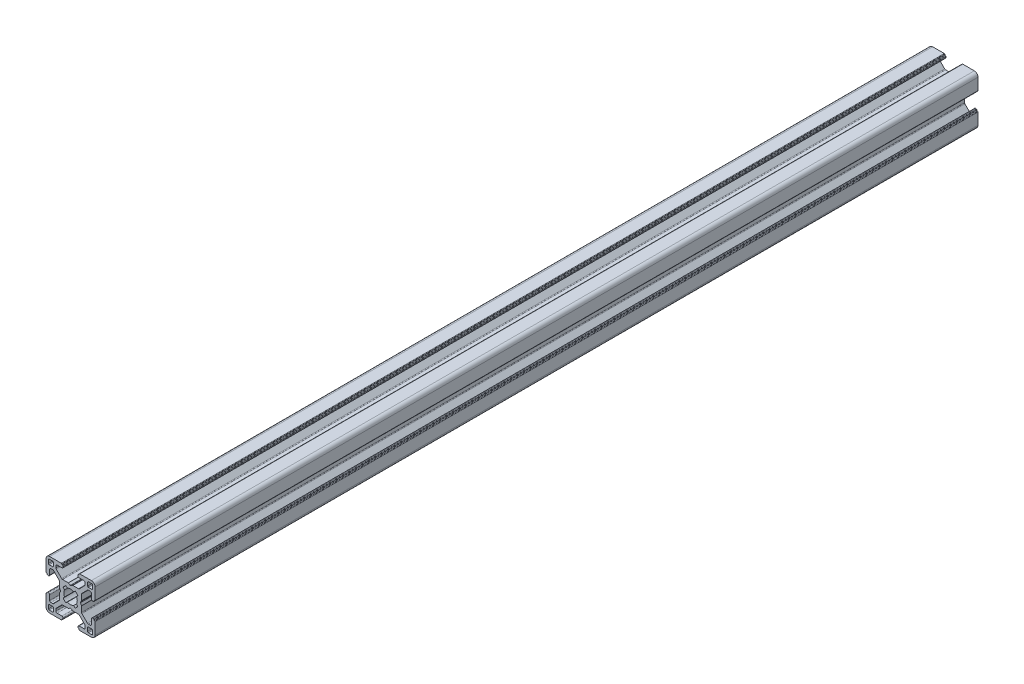
from build123d import *

# Parameters (mm, degrees)
ESTRUSIONE_ESTRUSIONE1_DEPTH = 360


with BuildPart() as part:
    # Schizzo1 → Estrusione-Estrusione1 (new body)
    with BuildSketch(Plane.XY.offset(100)):
        with BuildLine():
            Line((-9.299999732, 3), (-8.999999732, 3))
            ThreePointArc((-8.999999732, 3), (-8.646446341, 3.146446609), (-8.499999732, 3.5))
            Line((-8.499999732, 3.5), (-8.499999732, 5.499999605))
            ThreePointArc((-8.499999732, 5.499999605), (-8.353553123, 5.853552995), (-7.999999732, 5.999999605))
            Line((-7.999999732, 5.999999605), (-7.267766685, 5.999999605))
            ThreePointArc((-7.267766685, 5.999999605), (-7.076424969, 5.961939371), (-6.914213294, 5.853552995))
            Line((-6.914213294, 5.853552995), (-4.646446398, 3.585786099))
            ThreePointArc((-4.646446398, 3.585786099), (-4.538060023, 3.423574425), (-4.499999789, 3.232232708))
            Line((-4.499999789, 3.232232708), (-4.499999789, 0.953589302))
            ThreePointArc((-4.499999789, 0.953589302), (-4.493184953, 0.90182549), (-4.473204867, 0.853589297))
            Line((-4.473204867, 0.853589297), (-4.038119841, 0.099999969))
            ThreePointArc((-4.038119841, 0.099999969), (-4.011324929, 0), (-4.038119841, -0.099999969))
            Line((-4.038119841, -0.099999969), (-4.473204867, -0.853589297))
            ThreePointArc((-4.473204867, -0.853589297), (-4.493184953, -0.90182549), (-4.499999789, -0.953589302))
            Line((-4.499999789, -0.953589302), (-4.499999789, -3.232232708))
            ThreePointArc((-4.499999789, -3.232232708), (-4.538060023, -3.423574425), (-4.646446398, -3.585786099))
            Line((-4.646446398, -3.585786099), (-6.914213294, -5.853552995))
            ThreePointArc((-6.914213294, -5.853552995), (-7.076424969, -5.961939371), (-7.267766685, -5.999999605))
            Line((-7.267766685, -5.999999605), (-7.999999732, -5.999999605))
            ThreePointArc((-7.999999732, -5.999999605), (-8.353553123, -5.853552995), (-8.499999732, -5.499999605))
            Line((-8.499999732, -5.499999605), (-8.499999732, -3.5))
            ThreePointArc((-8.499999732, -3.5), (-8.646446341, -3.146446609), (-8.999999732, -3))
            Line((-8.999999732, -3), (-9.299999732, -3))
            ThreePointArc((-9.299999732, -3), (-9.441421088, -3.058578644), (-9.499999732, -3.2))
            Line((-9.499999732, -3.2), (-9.499999732, -3.349999605))
            ThreePointArc((-9.499999732, -3.349999605), (-9.558578376, -3.491420961), (-9.699999732, -3.549999605))
            Line((-9.699999732, -3.549999605), (-9.8, -3.549999605))
            ThreePointArc((-9.8, -3.549999605), (-9.941421356, -3.608578248), (-10, -3.749999605))
            Line((-10, -3.749999605), (-10, -8.5))
            ThreePointArc((-10, -8.5), (-9.560660172, -9.560660172), (-8.5, -10))
            Line((-8.5, -10), (-3.750000228, -10))
            ThreePointArc((-3.750000228, -10), (-3.608578871, -9.941421356), (-3.550000228, -9.8))
            Line((-3.550000228, -9.8), (-3.550000228, -9.7))
            ThreePointArc((-3.550000228, -9.7), (-3.491421584, -9.558578644), (-3.350000228, -9.5))
            Line((-3.350000228, -9.5), (-3.2, -9.5))
            ThreePointArc((-3.2, -9.5), (-3.058578644, -9.441421356), (-3, -9.3))
            Line((-3, -9.3), (-3, -8.999999673))
            ThreePointArc((-3, -8.999999673), (-3.146446609, -8.646446283), (-3.5, -8.499999673))
            Line((-3.5, -8.499999673), (-5.500000686, -8.499999673))
            ThreePointArc((-5.500000686, -8.499999673), (-5.853554077, -8.353553064), (-6.000000686, -7.999999673))
            Line((-6.000000686, -7.999999673), (-6.000000686, -7.267766626))
            ThreePointArc((-6.000000686, -7.267766626), (-5.961940448, -7.076424899), (-5.853554059, -6.914213219))
            Line((-5.853554059, -6.914213219), (-3.585787212, -4.646446592))
            ThreePointArc((-3.585787212, -4.646446592), (-3.423575544, -4.538060229), (-3.232233839, -4.5))
            Line((-3.232233839, -4.5), (-0.953590312, -4.5))
            ThreePointArc((-0.953590312, -4.5), (-0.901826505, -4.493185166), (-0.853590316, -4.473205083))
            Line((-0.853590316, -4.473205083), (-0.100000045, -4.038119562))
            ThreePointArc((-0.100000045, -4.038119562), (0, -4.011324632), (0.100000045, -4.038119562))
            Line((0.100000045, -4.038119562), (0.853590316, -4.473205083))
            ThreePointArc((0.853590316, -4.473205083), (0.901826505, -4.493185166), (0.953590312, -4.5))
            Line((0.953590312, -4.5), (3.23223292, -4.5))
            ThreePointArc((3.23223292, -4.5), (3.423574636, -4.538060234), (3.58578631, -4.646446609))
            Line((3.58578631, -4.646446609), (5.853554077, -6.914214376))
            ThreePointArc((5.853554077, -6.914214376), (5.961940452, -7.07642605), (6.000000686, -7.267767766))
            Line((6.000000686, -7.267767766), (6.000000686, -7.999999673))
            ThreePointArc((6.000000686, -7.999999673), (5.853554077, -8.353553064), (5.500000686, -8.499999673))
            Line((5.500000686, -8.499999673), (3.5, -8.499999673))
            ThreePointArc((3.5, -8.499999673), (3.146446609, -8.646446283), (3, -8.999999673))
            Line((3, -8.999999673), (3, -9.3))
            ThreePointArc((3, -9.3), (3.058578644, -9.441421356), (3.2, -9.5))
            Line((3.2, -9.5), (3.350000228, -9.5))
            ThreePointArc((3.350000228, -9.5), (3.491421584, -9.558578644), (3.550000228, -9.7))
            Line((3.550000228, -9.7), (3.550000228, -9.8))
            ThreePointArc((3.550000228, -9.8), (3.608578871, -9.941421356), (3.750000228, -10))
            Line((3.750000228, -10), (8.5, -10))
            ThreePointArc((8.5, -10), (9.560660172, -9.560660172), (10, -8.5))
            Line((10, -8.5), (10, -3.749999605))
            ThreePointArc((10, -3.749999605), (9.941421356, -3.608578248), (9.8, -3.549999605))
            Line((9.8, -3.549999605), (9.699999732, -3.549999605))
            ThreePointArc((9.699999732, -3.549999605), (9.558578376, -3.491420961), (9.499999732, -3.349999605))
            Line((9.499999732, -3.349999605), (9.499999732, -3.2))
            ThreePointArc((9.499999732, -3.2), (9.441421088, -3.058578644), (9.299999732, -3))
            Line((9.299999732, -3), (8.999999732, -3))
            ThreePointArc((8.999999732, -3), (8.646446341, -3.146446609), (8.499999732, -3.5))
            Line((8.499999732, -3.5), (8.499999732, -5.499999605))
            ThreePointArc((8.499999732, -5.499999605), (8.353553123, -5.853552995), (7.999999732, -5.999999605))
            Line((7.999999732, -5.999999605), (7.267766789, -5.999999605))
            ThreePointArc((7.267766789, -5.999999605), (7.076425084, -5.961939376), (6.914213416, -5.853553012))
            Line((6.914213416, -5.853553012), (4.646446415, -3.585786233))
            ThreePointArc((4.646446415, -3.585786233), (4.538060027, -3.423574553), (4.499999789, -3.232232825))
            Line((4.499999789, -3.232232825), (4.499999789, -0.953589302))
            ThreePointArc((4.499999789, -0.953589302), (4.493184953, -0.90182549), (4.473204867, -0.853589297))
            Line((4.473204867, -0.853589297), (4.038119841, -0.099999969))
            ThreePointArc((4.038119841, -0.099999969), (4.011324929, 0), (4.038119841, 0.099999969))
            Line((4.038119841, 0.099999969), (4.473204867, 0.853589297))
            ThreePointArc((4.473204867, 0.853589297), (4.493184953, 0.90182549), (4.499999789, 0.953589302))
            Line((4.499999789, 0.953589302), (4.499999789, 3.232232825))
            ThreePointArc((4.499999789, 3.232232825), (4.538060027, 3.423574553), (4.646446415, 3.585786233))
            Line((4.646446415, 3.585786233), (6.914213416, 5.853553012))
            ThreePointArc((6.914213416, 5.853553012), (7.076425084, 5.961939376), (7.267766789, 5.999999605))
            Line((7.267766789, 5.999999605), (7.999999732, 5.999999605))
            ThreePointArc((7.999999732, 5.999999605), (8.353553123, 5.853552995), (8.499999732, 5.499999605))
            Line((8.499999732, 5.499999605), (8.499999732, 3.5))
            ThreePointArc((8.499999732, 3.5), (8.646446341, 3.146446609), (8.999999732, 3))
            Line((8.999999732, 3), (9.299999732, 3))
            ThreePointArc((9.299999732, 3), (9.441421088, 3.058578644), (9.499999732, 3.2))
            Line((9.499999732, 3.2), (9.499999732, 3.349999605))
            ThreePointArc((9.499999732, 3.349999605), (9.558578376, 3.491420961), (9.699999732, 3.549999605))
            Line((9.699999732, 3.549999605), (9.8, 3.549999605))
            ThreePointArc((9.8, 3.549999605), (9.941421356, 3.608578248), (10, 3.749999605))
            Line((10, 3.749999605), (10, 8.5))
            ThreePointArc((10, 8.5), (9.560660172, 9.560660172), (8.5, 10))
            Line((8.5, 10), (3.750000228, 10))
            ThreePointArc((3.750000228, 10), (3.608578871, 9.941421356), (3.550000228, 9.8))
            Line((3.550000228, 9.8), (3.550000228, 9.7))
            ThreePointArc((3.550000228, 9.7), (3.491421584, 9.558578644), (3.350000228, 9.5))
            Line((3.350000228, 9.5), (3.2, 9.5))
            ThreePointArc((3.2, 9.5), (3.058578644, 9.441421356), (3, 9.3))
            Line((3, 9.3), (3, 8.999999673))
            ThreePointArc((3, 8.999999673), (3.146446609, 8.646446283), (3.5, 8.499999673))
            Line((3.5, 8.499999673), (5.500000686, 8.499999673))
            ThreePointArc((5.500000686, 8.499999673), (5.853554077, 8.353553064), (6.000000686, 7.999999673))
            Line((6.000000686, 7.999999673), (6.000000686, 7.267767766))
            ThreePointArc((6.000000686, 7.267767766), (5.961940452, 7.07642605), (5.853554077, 6.914214376))
            Line((5.853554077, 6.914214376), (3.58578631, 4.646446609))
            ThreePointArc((3.58578631, 4.646446609), (3.423574636, 4.538060234), (3.23223292, 4.5))
            Line((3.23223292, 4.5), (0.953590312, 4.5))
            ThreePointArc((0.953590312, 4.5), (0.901826505, 4.493185166), (0.853590316, 4.473205083))
            Line((0.853590316, 4.473205083), (0.100000045, 4.038119562))
            ThreePointArc((0.100000045, 4.038119562), (0, 4.011324632), (-0.100000045, 4.038119562))
            Line((-0.100000045, 4.038119562), (-0.853590316, 4.473205083))
            ThreePointArc((-0.853590316, 4.473205083), (-0.901826505, 4.493185166), (-0.953590312, 4.5))
            Line((-0.953590312, 4.5), (-3.232233839, 4.5))
            ThreePointArc((-3.232233839, 4.5), (-3.423575544, 4.538060229), (-3.585787212, 4.646446592))
            Line((-3.585787212, 4.646446592), (-5.853554059, 6.914213219))
            ThreePointArc((-5.853554059, 6.914213219), (-5.961940448, 7.076424899), (-6.000000686, 7.267766626))
            Line((-6.000000686, 7.267766626), (-6.000000686, 7.999999673))
            ThreePointArc((-6.000000686, 7.999999673), (-5.853554077, 8.353553064), (-5.500000686, 8.499999673))
            Line((-5.500000686, 8.499999673), (-3.5, 8.499999673))
            ThreePointArc((-3.5, 8.499999673), (-3.146446609, 8.646446283), (-3, 8.999999673))
            Line((-3, 8.999999673), (-3, 9.3))
            ThreePointArc((-3, 9.3), (-3.058578644, 9.441421356), (-3.2, 9.5))
            Line((-3.2, 9.5), (-3.350000228, 9.5))
            ThreePointArc((-3.350000228, 9.5), (-3.491421584, 9.558578644), (-3.550000228, 9.7))
            Line((-3.550000228, 9.7), (-3.550000228, 9.8))
            ThreePointArc((-3.550000228, 9.8), (-3.608578871, 9.941421356), (-3.750000228, 10))
            Line((-3.750000228, 10), (-8.5, 10))
            ThreePointArc((-8.5, 10), (-9.560660172, 9.560660172), (-10, 8.5))
            Line((-10, 8.5), (-10, 3.749999605))
            ThreePointArc((-10, 3.749999605), (-9.941421356, 3.608578248), (-9.8, 3.549999605))
            Line((-9.8, 3.549999605), (-9.699999732, 3.549999605))
            ThreePointArc((-9.699999732, 3.549999605), (-9.558578376, 3.491420961), (-9.499999732, 3.349999605))
            Line((-9.499999732, 3.349999605), (-9.499999732, 3.2))
            ThreePointArc((-9.499999732, 3.2), (-9.441421088, 3.058578644), (-9.299999732, 3))
        make_face()
        with BuildLine():
            Line((-1.91389502, 2.989640962), (-1.258185436, 2.445295362))
            ThreePointArc((-1.258185436, 2.445295362), (0, 2.75), (1.258185436, 2.445295362))
            Line((1.258185436, 2.445295362), (1.91389502, 2.989640962))
            ThreePointArc((1.91389502, 2.989640962), (2.511737261, 2.508410485), (2.992174953, 1.909930962))
            Line((2.992174953, 1.909930962), (2.445295423, 1.258185317))
            ThreePointArc((2.445295423, 1.258185317), (2.75, 0), (2.445295423, -1.258185317))
            Line((2.445295423, -1.258185317), (2.992174953, -1.909930962))
            ThreePointArc((2.992174953, -1.909930962), (2.511737261, -2.508410485), (1.91389502, -2.989640962))
            Line((1.91389502, -2.989640962), (1.258185436, -2.445295362))
            ThreePointArc((1.258185436, -2.445295362), (0, -2.75), (-1.258185436, -2.445295362))
            Line((-1.258185436, -2.445295362), (-1.91389502, -2.989640962))
            ThreePointArc((-1.91389502, -2.989640962), (-2.511737261, -2.508410485), (-2.992174953, -1.909930962))
            Line((-2.992174953, -1.909930962), (-2.445295423, -1.258185317))
            ThreePointArc((-2.445295423, -1.258185317), (-2.75, 0), (-2.445295423, 1.258185317))
            Line((-2.445295423, 1.258185317), (-2.992174953, 1.909930962))
            ThreePointArc((-2.992174953, 1.909930962), (-2.511737261, 2.508410485), (-1.91389502, 2.989640962))
        make_face(mode=Mode.SUBTRACT)
        with BuildLine():
            Line((8.699999314, 7.000000686), (7.3, 7.000000686))
            ThreePointArc((7.3, 7.000000686), (7.087867966, 7.087868652), (7, 7.300000686))
            Line((7, 7.300000686), (7, 8.7))
            ThreePointArc((7, 8.7), (7.087867966, 8.912132034), (7.3, 9))
            Line((7.3, 9), (8.699999314, 9))
            ThreePointArc((8.699999314, 9), (8.912131348, 8.912132034), (8.999999314, 8.7))
            Line((8.999999314, 8.7), (8.999999314, 7.300000686))
            ThreePointArc((8.999999314, 7.300000686), (8.912131348, 7.087868652), (8.699999314, 7.000000686))
        make_face(mode=Mode.SUBTRACT)
        with BuildLine():
            Line((-7.300000686, 7.000000686), (-8.7, 7.000000686))
            ThreePointArc((-8.7, 7.000000686), (-8.912132034, 7.087868652), (-9, 7.300000686))
            Line((-9, 7.300000686), (-9, 8.7))
            ThreePointArc((-9, 8.7), (-8.912132034, 8.912132034), (-8.7, 9))
            Line((-8.7, 9), (-7.300000686, 9))
            ThreePointArc((-7.300000686, 9), (-7.087868652, 8.912132034), (-7.000000686, 8.7))
            Line((-7.000000686, 8.7), (-7.000000686, 7.300000686))
            ThreePointArc((-7.000000686, 7.300000686), (-7.087868652, 7.087868652), (-7.300000686, 7.000000686))
        make_face(mode=Mode.SUBTRACT)
        with BuildLine():
            Line((8.699999314, -8.999999314), (7.3, -8.999999314))
            ThreePointArc((7.3, -8.999999314), (7.087867966, -8.912131348), (7, -8.699999314))
            Line((7, -8.699999314), (7, -7.3))
            ThreePointArc((7, -7.3), (7.087867966, -7.087867966), (7.3, -7))
            Line((7.3, -7), (8.699999314, -7))
            ThreePointArc((8.699999314, -7), (8.912131348, -7.087867966), (8.999999314, -7.3))
            Line((8.999999314, -7.3), (8.999999314, -8.699999314))
            ThreePointArc((8.999999314, -8.699999314), (8.912131348, -8.912131348), (8.699999314, -8.999999314))
        make_face(mode=Mode.SUBTRACT)
        with BuildLine():
            Line((-7.300000686, -8.999999314), (-8.7, -8.999999314))
            ThreePointArc((-8.7, -8.999999314), (-8.912132034, -8.912131348), (-9, -8.699999314))
            Line((-9, -8.699999314), (-9, -7.3))
            ThreePointArc((-9, -7.3), (-8.912132034, -7.087867966), (-8.7, -7))
            Line((-8.7, -7), (-7.300000686, -7))
            ThreePointArc((-7.300000686, -7), (-7.087868652, -7.087867966), (-7.000000686, -7.3))
            Line((-7.000000686, -7.3), (-7.000000686, -8.699999314))
            ThreePointArc((-7.000000686, -8.699999314), (-7.087868652, -8.912131348), (-7.300000686, -8.999999314))
        make_face(mode=Mode.SUBTRACT)
    extrude(amount=-ESTRUSIONE_ESTRUSIONE1_DEPTH)


solid = part.part
